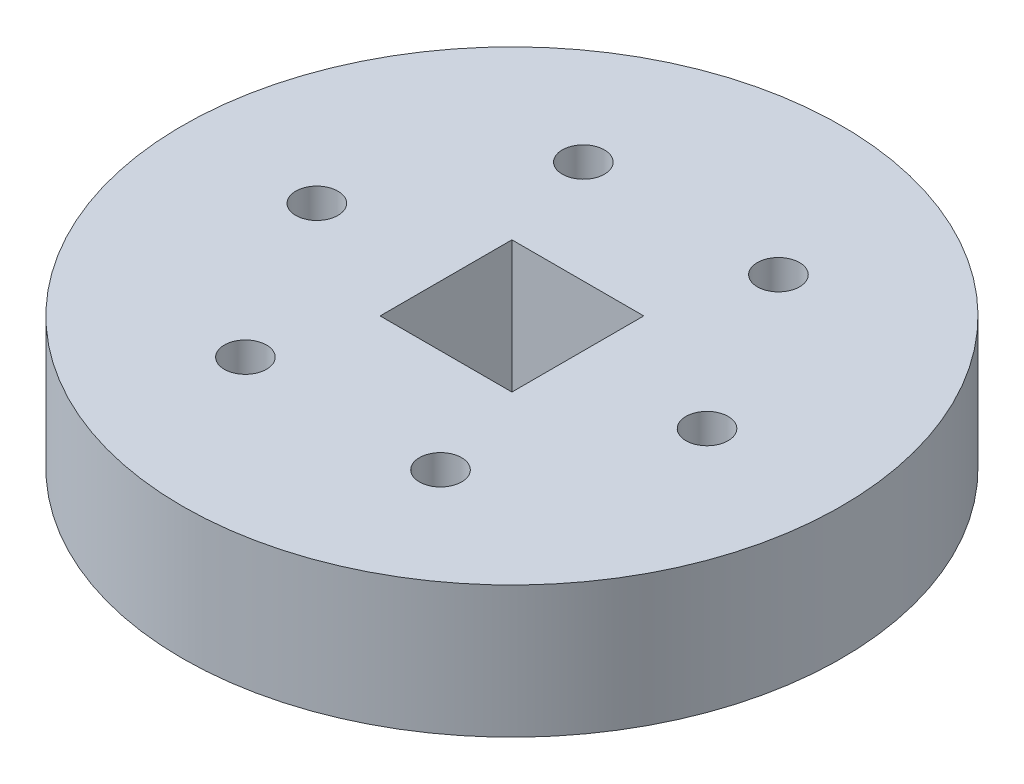
from build123d import *

# Parameters (mm, degrees)
ELEVATOR_SUPPORT_PULLEYS_R   = 15.875
ELEVATOR_SUPPORT_PULLEYS_R_2 = 1.016
ELEVATOR_SUPPORT_PULLEYS_W   = 6.35
ELEVATOR_SUPPORT_PULLEYS_H   = 6.35
BOSS_EXTRUDE1_DEPTH          = 6.35


with BuildPart() as part:
    # Elevator Support Pulleys → Boss-Extrude1 (new body)
    with BuildSketch(Plane(origin=(0, 0, 0), x_dir=(1, 0, 0), z_dir=(0, 1, 0))):
        with Locations(Location((0, 0, 0), (0, 0, 270))):
            Circle(ELEVATOR_SUPPORT_PULLEYS_R)
        with Locations(Location((9.398, 0, 0), (0, 0, 270))):
            Circle(ELEVATOR_SUPPORT_PULLEYS_R_2, mode=Mode.SUBTRACT)
        with Locations(Location((4.699, -8.138906745, 0), (0, 0, 270))):
            Circle(ELEVATOR_SUPPORT_PULLEYS_R_2, mode=Mode.SUBTRACT)
        with Locations(Location((-4.699, -8.138906745, 0), (0, 0, 270))):
            Circle(ELEVATOR_SUPPORT_PULLEYS_R_2, mode=Mode.SUBTRACT)
        with Locations(Location((-9.398, 0, 0), (0, 0, 270))):
            Circle(ELEVATOR_SUPPORT_PULLEYS_R_2, mode=Mode.SUBTRACT)
        with Locations(Location((-4.699, 8.138906745, 0), (0, 0, 270))):
            Circle(ELEVATOR_SUPPORT_PULLEYS_R_2, mode=Mode.SUBTRACT)
        with Locations(Location((4.699, 8.138906745, 0), (0, 0, 270))):
            Circle(ELEVATOR_SUPPORT_PULLEYS_R_2, mode=Mode.SUBTRACT)
        Rectangle(ELEVATOR_SUPPORT_PULLEYS_W, ELEVATOR_SUPPORT_PULLEYS_H, mode=Mode.SUBTRACT)
    extrude(amount=BOSS_EXTRUDE1_DEPTH)


solid = part.part
